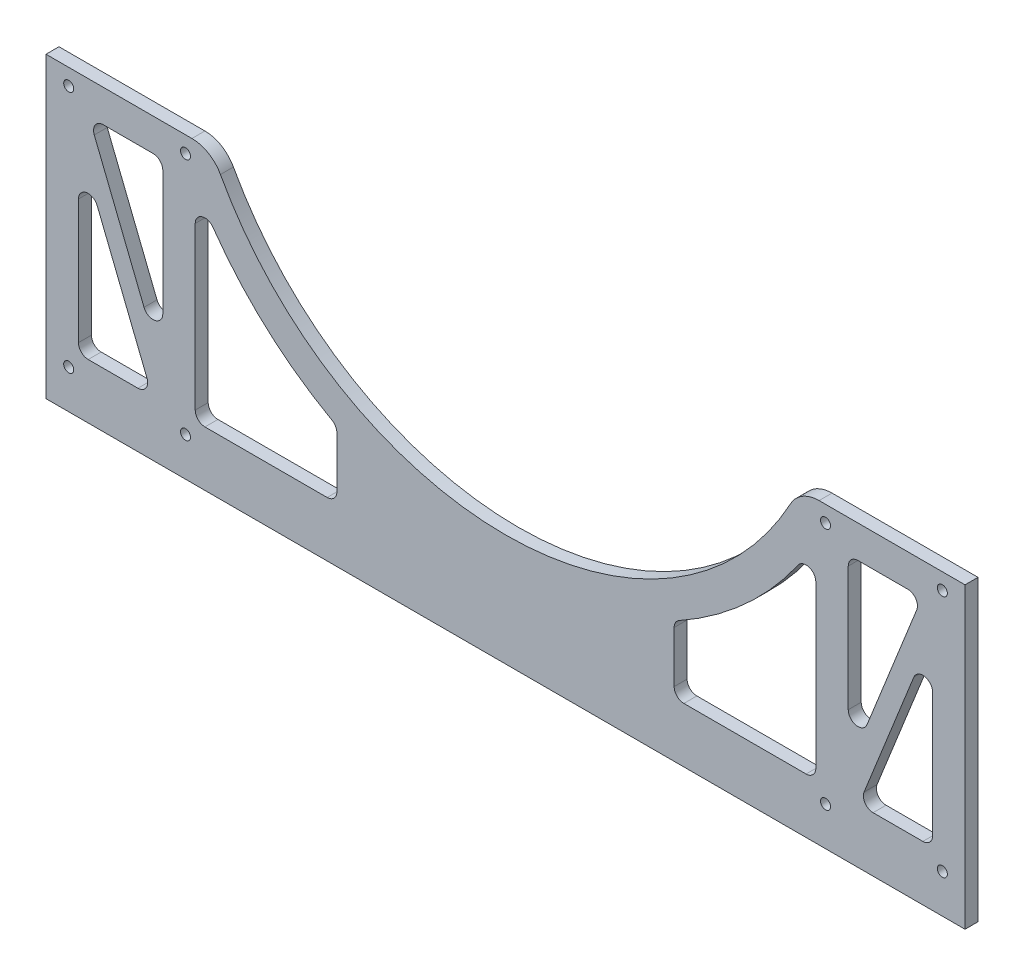
from build123d import *

# Parameters (mm, degrees)
BOSS_EXTRUDE1_DEPTH = 4
SKETCH2_R           = 1.55
CUT_EXTRUDE1_DEPTH  = 10
FILLET1_R           = 10
SKETCH3_W           = 283.3
SKETCH3_H           = 4
BOSS_EXTRUDE2_DEPTH = 6.958779143


with BuildPart() as part:
    # Sketch1 → Boss-Extrude1 (new body)
    with BuildSketch(Plane.XY):
        with BuildLine():
            Line((-141.65, 42.5), (-141.65, -42.5))
            Line((-141.65, -42.5), (141.65, -42.5))
            Line((141.65, -42.5), (141.65, 42.5))
            Line((141.65, 42.5), (90.519334951, 42.5))
            ThreePointArc((90.519334951, 42.5), (0, -15), (-90.519334951, 42.5))
            Line((-90.519334951, 42.5), (-141.65, 42.5))
        make_face()
    extrude(amount=BOSS_EXTRUDE1_DEPTH)

    # Sketch2 → Cut-Extrude1 (cut)
    with BuildSketch(Plane.XY.offset(4)):
        with BuildLine():
            Line((-125.864569927, 9.958677608), (-110.526767696, -28.385827971))
            ThreePointArc((-110.526767696, -28.385827971), (-110.827996077, -31.181886428), (-113.312197769, -32.5))
            Line((-113.312197769, -32.5), (-128.65, -32.5))
            ThreePointArc((-128.65, -32.5), (-130.771320344, -31.621320344), (-131.65, -29.5))
            Line((-131.65, -29.5), (-131.65, 8.844505579))
            ThreePointArc((-131.65, 8.844505579), (-129.217322563, 11.790374739), (-125.864569927, 9.958677608))
        make_face()
        with BuildLine():
            ThreePointArc((-126.773232304, 28.385827971), (-126.472003923, 31.181886428), (-123.987802231, 32.5))
            Line((-123.987802231, 32.5), (-108.65, 32.5))
            ThreePointArc((-108.65, 32.5), (-106.528679656, 31.621320344), (-105.65, 29.5))
            Line((-105.65, 29.5), (-105.65, -8.844505579))
            ThreePointArc((-105.65, -8.844505579), (-108.082677437, -11.790374739), (-111.435430073, -9.958677608))
            Line((-111.435430073, -9.958677608), (-126.773232304, 28.385827971))
        make_face()
        with BuildLine():
            ThreePointArc((-95.65, 20.308597944), (-93.550221212, 23.170345971), (-90.190265487, 22.026068795))
            ThreePointArc((-90.190265487, 22.026068795), (-73.741634921, 3.377875064), (-53.524791107, -11.0994107))
            ThreePointArc((-53.524791107, -11.0994107), (-52.39812226, -12.200320346), (-51.984558137, -13.72030372))
            Line((-51.984558137, -13.72030372), (-51.984558137, -29.5))
            ThreePointArc((-51.984558137, -29.5), (-52.863237794, -31.621320344), (-54.984558137, -32.5))
            Line((-54.984558137, -32.5), (-92.65, -32.5))
            ThreePointArc((-92.65, -32.5), (-94.771320344, -31.621320344), (-95.65, -29.5))
            Line((-95.65, -29.5), (-95.65, 20.308597944))
        make_face()
        with BuildLine():
            ThreePointArc((95.65, 20.308597944), (93.550221212, 23.170345971), (90.190265487, 22.026068795))
            ThreePointArc((90.190265487, 22.026068795), (73.741634921, 3.377875064), (53.524791107, -11.0994107))
            ThreePointArc((53.524791107, -11.0994107), (52.39812226, -12.200320346), (51.984558137, -13.72030372))
            Line((51.984558137, -13.72030372), (51.984558137, -29.5))
            ThreePointArc((51.984558137, -29.5), (52.863237794, -31.621320344), (54.984558137, -32.5))
            Line((54.984558137, -32.5), (92.65, -32.5))
            ThreePointArc((92.65, -32.5), (94.771320344, -31.621320344), (95.65, -29.5))
            Line((95.65, -29.5), (95.65, 20.308597944))
        make_face()
        with BuildLine():
            ThreePointArc((111.435430073, -9.958677608), (108.082677437, -11.790374739), (105.65, -8.844505579))
            Line((105.65, -8.844505579), (105.65, 29.5))
            ThreePointArc((105.65, 29.5), (106.528679656, 31.621320344), (108.65, 32.5))
            Line((108.65, 32.5), (123.987802231, 32.5))
            ThreePointArc((123.987802231, 32.5), (126.472003923, 31.181886428), (126.773232304, 28.385827971))
            Line((126.773232304, 28.385827971), (111.435430073, -9.958677608))
        make_face()
        with BuildLine():
            Line((128.65, -32.5), (113.312197769, -32.5))
            ThreePointArc((113.312197769, -32.5), (110.827996077, -31.181886428), (110.526767696, -28.385827971))
            Line((110.526767696, -28.385827971), (125.864569927, 9.958677608))
            ThreePointArc((125.864569927, 9.958677608), (129.217322563, 11.790374739), (131.65, 8.844505579))
            Line((131.65, 8.844505579), (131.65, -29.5))
            ThreePointArc((131.65, -29.5), (130.771320344, -31.621320344), (128.65, -32.5))
        make_face()
        with Locations((-134.65, 37.5)):
            Circle(SKETCH2_R)
        with Locations((-98.65, 37.5)):
            Circle(SKETCH2_R)
        with Locations((-98.65, -37.5)):
            Circle(SKETCH2_R)
        with Locations((-134.65, -37.5)):
            Circle(SKETCH2_R)
        with Locations((98.65, -37.5)):
            Circle(SKETCH2_R)
        with Locations((134.65, -37.5)):
            Circle(SKETCH2_R)
        with Locations((98.65, 37.5)):
            Circle(SKETCH2_R)
        with Locations((134.65, 37.5)):
            Circle(SKETCH2_R)
    extrude(amount=-CUT_EXTRUDE1_DEPTH, mode=Mode.SUBTRACT)

    # Fillet1
    fillet1_edges = [part.edges().sort_by_distance(p)[0] for p in [
        (90.519334951, 42.5, 2),
        (-90.519334951, 42.5, 2),
    ]]
    fillet(fillet1_edges, radius=FILLET1_R)

    # Sketch3 → Boss-Extrude2 (add)
    with BuildSketch(Plane.XZ.offset(42.5)):
        with Locations((0, 2)):
            Rectangle(SKETCH3_W, SKETCH3_H)
    extrude(amount=BOSS_EXTRUDE2_DEPTH)


solid = part.part
